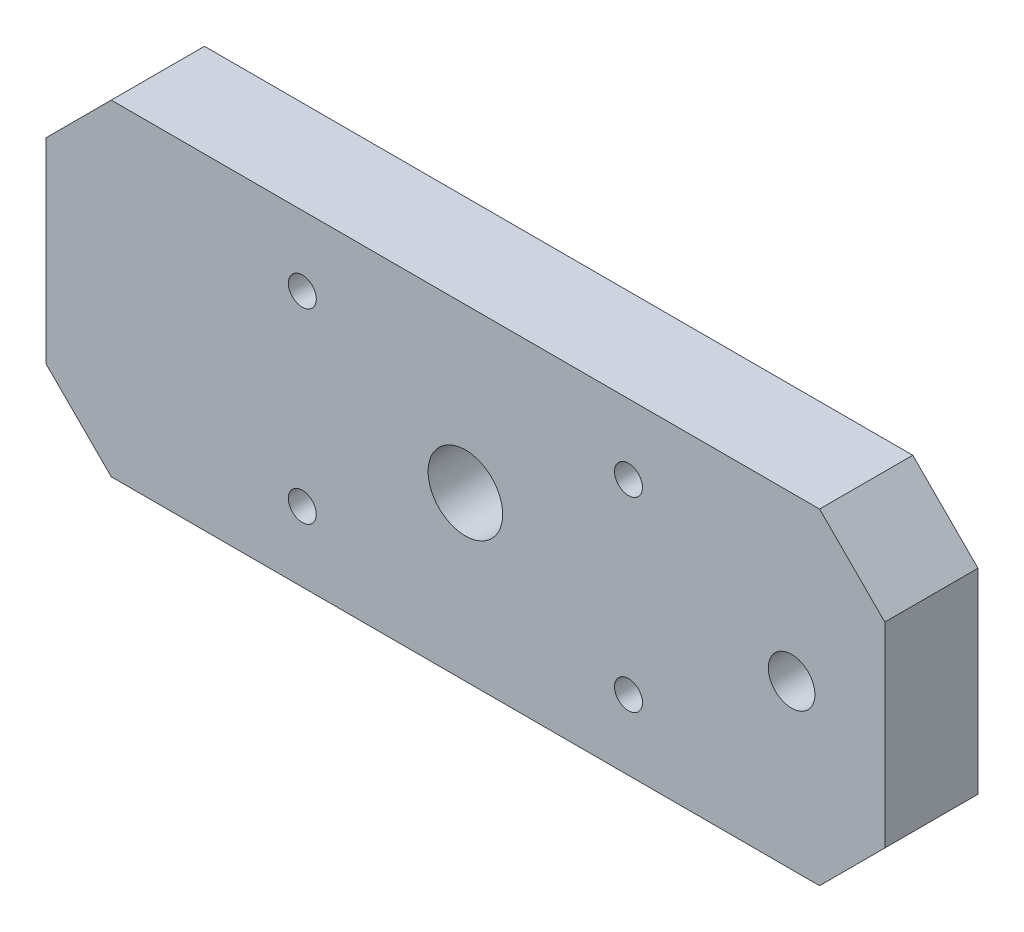
from build123d import *

# Parameters (mm, degrees)
SKETCH_1_W      = 90
SKETCH_1_H      = 35
SKETCH_1_R      = 2.5
SKETCH_1_R_2    = 4
SKETCH_1_R_3    = 1.5
EXTRUDE_1_DEPTH = 10
CHAMFER_1_SIZE  = 7


with BuildPart() as part:
    # ｽｹｯﾁ1 → ﾎﾞｽ - 押し出し1 (new body)
    with BuildSketch(Plane.XY):
        Rectangle(SKETCH_1_W, SKETCH_1_H)
        with Locations((35, 0)):
            Circle(SKETCH_1_R, mode=Mode.SUBTRACT)
        Circle(SKETCH_1_R_2, mode=Mode.SUBTRACT)
        with Locations((17.5, 10)):
            Circle(SKETCH_1_R_3, mode=Mode.SUBTRACT)
        with Locations(Location((17.5, -10, 0), (0, 0, 180))):
            Circle(SKETCH_1_R_3, mode=Mode.SUBTRACT)
        with Locations(Location((-17.5, 10, 0), (0, 0, 180))):
            Circle(SKETCH_1_R_3, mode=Mode.SUBTRACT)
        with Locations((-17.5, -10)):
            Circle(SKETCH_1_R_3, mode=Mode.SUBTRACT)
    extrude(amount=EXTRUDE_1_DEPTH)

    # 面取り1
    chamfer_1_edges = [part.edges().sort_by_distance(p)[0] for p in [
        (-45, 17.5, 5),
        (45, 17.5, 5),
        (45, -17.5, 5),
        (-45, -17.5, 5),
    ]]
    chamfer(chamfer_1_edges, length=CHAMFER_1_SIZE)


solid = part.part
